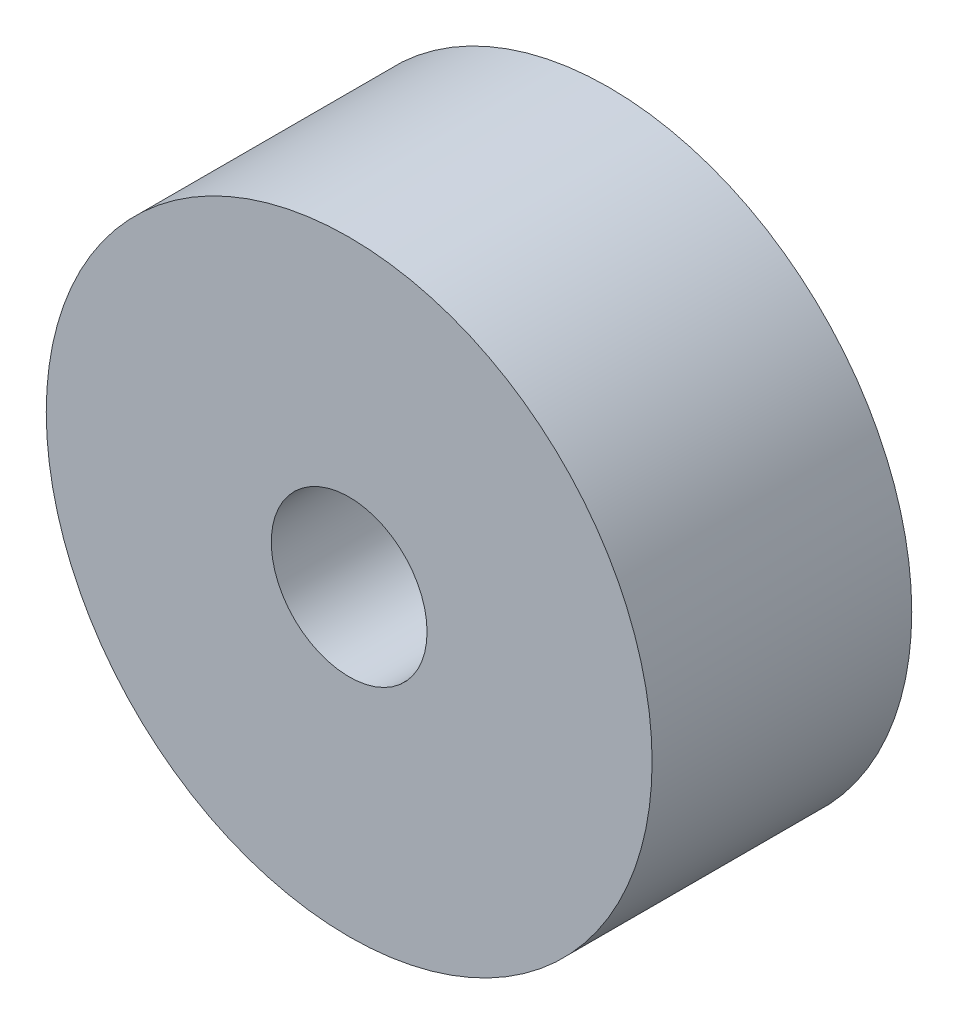
from build123d import *

# Parameters (mm, degrees)
SKETCH1_R           = 350
SKETCH1_R_2         = 90
BOSS_EXTRUDE1_DEPTH = 300


with BuildPart() as part:
    # Sketch1 → Boss-Extrude1 (new body)
    with BuildSketch(Plane.XY):
        Circle(SKETCH1_R)
        Circle(SKETCH1_R_2, mode=Mode.SUBTRACT)
    extrude(amount=BOSS_EXTRUDE1_DEPTH)


solid = part.part
